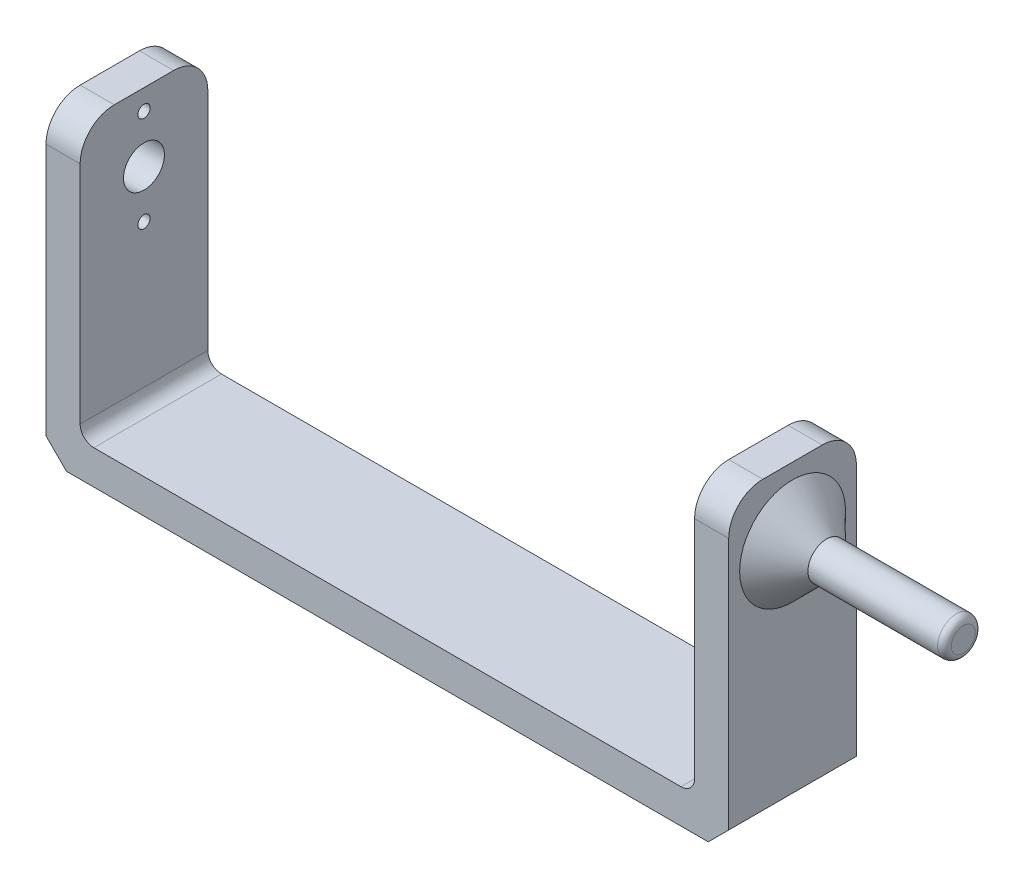
from build123d import *

# Parameters (mm, degrees)
BOSS_EXTRUDE1_DEPTH      = 18.7
FILLET1_R                = 5
FILLET2_R                = 2
CHAMFER1_SIZE            = 3
SKETCH2_R                = 3
SKETCH2_R_2              = 0.9
CUT_EXTRUDE1_DEPTH       = 18.7
SKETCH3_R                = 0.414419125
CUT_EXTRUDE2_DEPTH       = 118.7
BOSS_EXTRUDE2_DEPTH      = 25
BOSS_EXTRUDE2_DEPTH_BACK = 5
SKETCH4_R                = 2.75
CHAMFER2_SIZE            = 5
FILLET3_R                = 1


with BuildPart() as part:
    # Sketch1 → Boss-Extrude1 (new body)
    with BuildSketch(Plane.XY):
        Polygon((-45, -16.035242291), (45, -16.035242291), (45, 23.964757709), (50, 23.964757709), (50, -16.035242291), (50, -21.035242291), (-50, -21.035242291), (-50, -16.035242291), (-50, 23.964757709), (-45, 23.964757709), align=None)
    extrude(amount=BOSS_EXTRUDE1_DEPTH)

    # Fillet1
    fillet1_edges = [part.edges().sort_by_distance(p)[0] for p in [
        (47.5, 23.964757709, 18.7),
        (-47.5, 23.964757709, 0),
        (47.5, 23.964757709, 0),
        (-47.5, 23.964757709, 18.7),
    ]]
    fillet(fillet1_edges, radius=FILLET1_R)

    # Fillet2
    fillet2_edges = [part.edges().sort_by_distance(p)[0] for p in [
        (-45, -16.035242291, 9.35),
        (45, -16.035242291, 9.35),
    ]]
    fillet(fillet2_edges, radius=FILLET2_R)

    # Chamfer1
    chamfer1_edges = [part.edges().sort_by_distance(p)[0] for p in [
        (50, -21.035242291, 9.35),
        (-50, -21.035242291, 9.35),
    ]]
    chamfer(chamfer1_edges, length=CHAMFER1_SIZE)

    # Sketch2 → Cut-Extrude1 (cut)
    with BuildSketch(Plane.ZY.offset(50)):
        with Locations((9.35, 13.964757709)):
            Circle(SKETCH2_R)
        with Locations((9.35, 20.964757709)):
            Circle(SKETCH2_R_2)
        with Locations((9.35, 6.964757709)):
            Circle(SKETCH2_R_2)
    extrude(amount=-CUT_EXTRUDE1_DEPTH, mode=Mode.SUBTRACT)

    # Sketch3 → Cut-Extrude2 (cut)
    with BuildSketch(Plane.ZY.offset(50)):
        with Locations((9.35, 13.964757709)):
            Circle(SKETCH3_R)
    extrude(amount=-CUT_EXTRUDE2_DEPTH, mode=Mode.SUBTRACT)

    # Sketch4 → Boss-Extrude2 (add, two sides: drawn at the far end of the back side and taken through both)
    with BuildSketch(Plane(origin=(50, 0, 0), x_dir=(0, 0, -1), z_dir=(1, 0, 0)).offset(-BOSS_EXTRUDE2_DEPTH_BACK)):
        with Locations((-9.35, 13.964757709)):
            Circle(SKETCH4_R)
    extrude(amount=BOSS_EXTRUDE2_DEPTH + BOSS_EXTRUDE2_DEPTH_BACK)

    # Chamfer2
    chamfer2_edges = [part.edges().sort_by_distance(p)[0] for p in [
        (50, 13.964757709, 12.1),
    ]]
    chamfer(chamfer2_edges, length=CHAMFER2_SIZE)

    # Fillet3
    fillet3_edges = [part.edges().sort_by_distance(p)[0] for p in [
        (75, 13.964757709, 12.1),
    ]]
    fillet(fillet3_edges, radius=FILLET3_R)


solid = part.part
